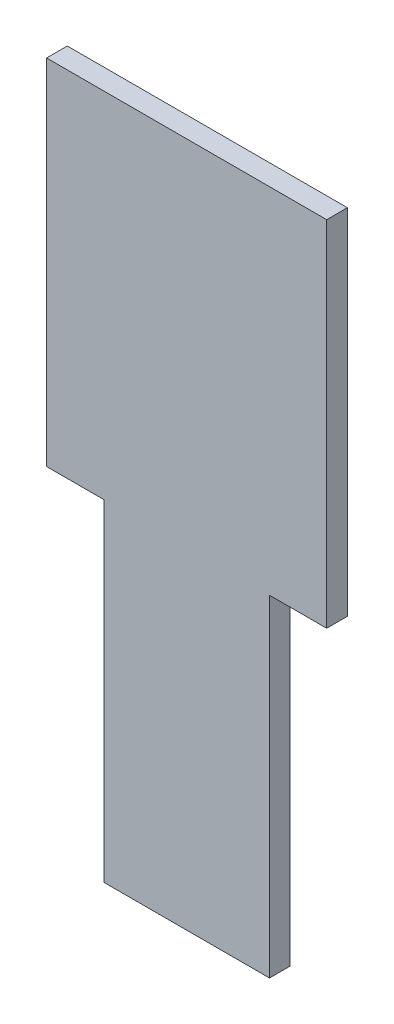
from build123d import *

# Parameters (mm, degrees)
SKETCH1_W           = 85.852
SKETCH1_H           = 210.058
BOSS_EXTRUDE1_DEPTH = 6.35
CUT_EXTRUDE1_REACH  = 115.64
SKETCH2_W           = 17.526
SKETCH2_H           = 101.6
SKETCH2_W_2         = 17.653


with BuildPart() as part:
    # Sketch1 → Boss-Extrude1 (new body)
    with BuildSketch(Plane.XY):
        Rectangle(SKETCH1_W, SKETCH1_H)
    extrude(amount=BOSS_EXTRUDE1_DEPTH)

    # Sketch2 → Cut-Extrude1 (cut, up to next)
    with BuildSketch(Plane.XY.offset(6.35), mode=Mode.PRIVATE) as cut_extrude1_sk1:
        with Locations((34.163, -54.229)):
            Rectangle(SKETCH2_W, SKETCH2_H)
    cut_extrude1_tool1 = extrude(cut_extrude1_sk1.sketch, amount=-CUT_EXTRUDE1_REACH, mode=Mode.PRIVATE) & part.part
    # Sketch2 → Cut-Extrude1 (cut, up to next)
    with BuildSketch(Plane.XY.offset(6.35), mode=Mode.PRIVATE) as cut_extrude1_sk2:
        with Locations((-34.0995, -54.229)):
            Rectangle(SKETCH2_W_2, SKETCH2_H)
    cut_extrude1_tool2 = extrude(cut_extrude1_sk2.sketch, amount=-CUT_EXTRUDE1_REACH, mode=Mode.PRIVATE) & part.part
    add(cut_extrude1_tool1.solids().sort_by_distance((34.163, -54.229, 6.35))[0], mode=Mode.SUBTRACT)
    add(cut_extrude1_tool2.solids().sort_by_distance((-34.0995, -54.229, 6.35))[0], mode=Mode.SUBTRACT)


solid = part.part
